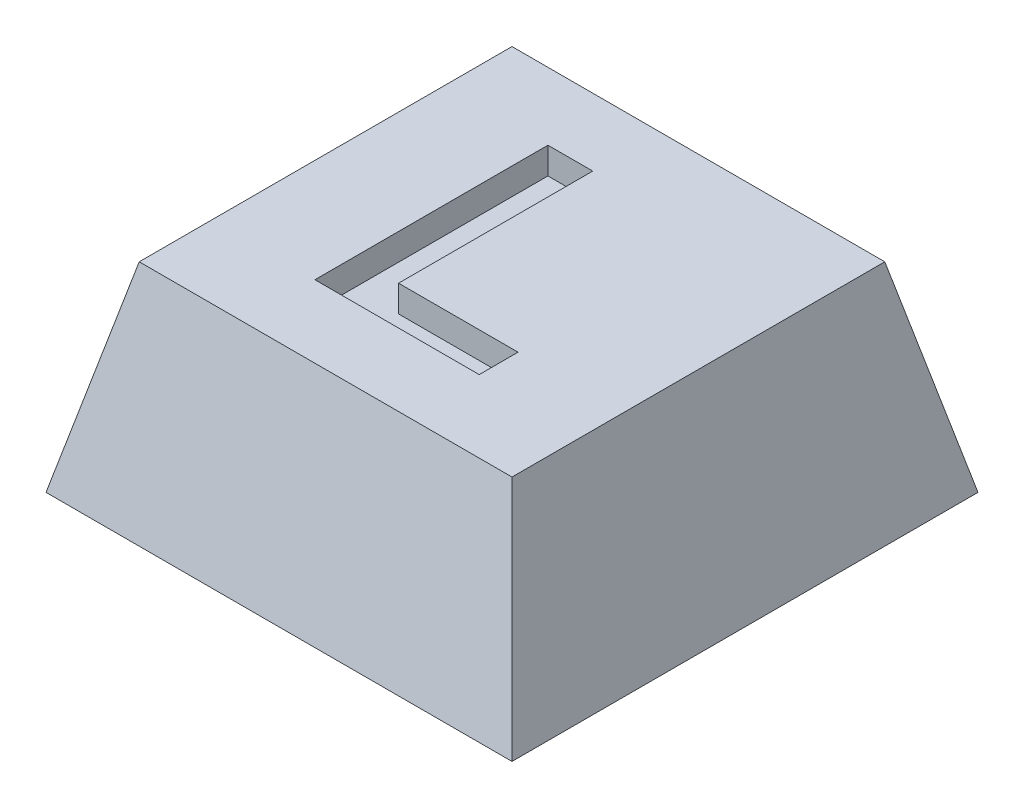
from build123d import *

# Parameters (mm, degrees)
SKETCH1_W           = 7
SKETCH1_H           = 7
BOSS_EXTRUDE1_DEPTH = 3
CUT_EXTRUDE1_DEPTH  = 7
CUT_EXTRUDE2_DEPTH  = 11
SKETCH4_R           = 1.8
CUT_EXTRUDE3_DEPTH  = 0.8
CUT_EXTRUDE4_DEPTH  = 0.4


with BuildPart() as part:
    # Sketch1 → Boss-Extrude1 (new body)
    with BuildSketch(Plane(origin=(0, 0, 0), x_dir=(1, 0, 0), z_dir=(0, 1, 0))):
        with Locations((3.5, 3.5)):
            Rectangle(SKETCH1_W, SKETCH1_H)
    extrude(amount=BOSS_EXTRUDE1_DEPTH)

    # Sketch2 → Cut-Extrude1 (cut)
    with BuildSketch(Plane.XY):
        Polygon((0, 0), (0.7, 3), (0, 3), align=None)
        Polygon((7, 0), (6.3, 3), (7, 3), align=None)
    extrude(amount=-CUT_EXTRUDE1_DEPTH, mode=Mode.SUBTRACT)

    # Sketch3 → Cut-Extrude2 (cut)
    with BuildSketch(Plane(origin=(0, 0, 0), x_dir=(0, 0, -1), z_dir=(1, 0, 0))):
        Polygon((0, 0), (0.7, 3), (0, 3), align=None)
        Polygon((7, 3), (6.3, 3), (7, 0), align=None)
    extrude(amount=CUT_EXTRUDE2_DEPTH, mode=Mode.SUBTRACT)

    # Sketch4 → Cut-Extrude3 (cut)
    with BuildSketch(Plane.XZ):
        with Locations(Location((3.5, -3.5, 0), (0, 0, 270))):
            Circle(SKETCH4_R)
    extrude(amount=-CUT_EXTRUDE3_DEPTH, mode=Mode.SUBTRACT)

    # Sketch5 → Cut-Extrude4 (cut)
    with BuildSketch(Plane(origin=(0, 3, 0), x_dir=(1, 0, 0), z_dir=(0, 1, 0))):
        Polygon((2.253196063, 1.786270222), (2.253196063, 5.286270222), (2.926272986, 5.286270222), (2.926272986, 2.369603555), (4.721144781, 2.369603555), (4.721144781, 1.786270222), align=None)
    extrude(amount=-CUT_EXTRUDE4_DEPTH, mode=Mode.SUBTRACT)


solid = part.part
